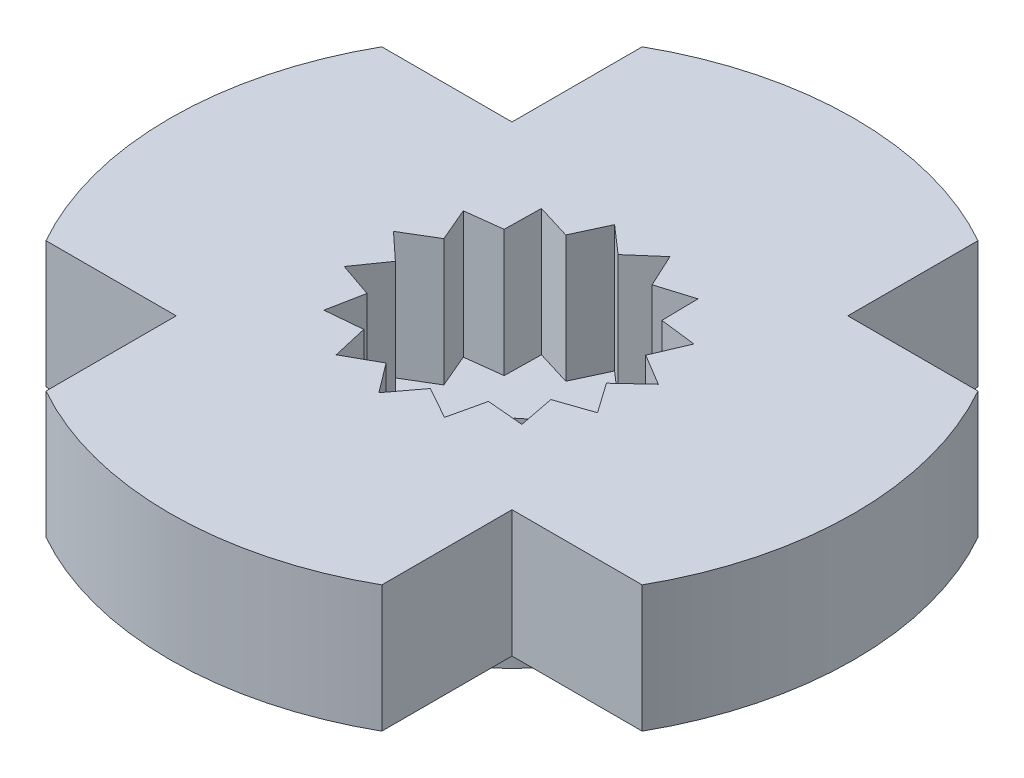
from build123d import *

# Parameters (mm, degrees)
EXTRUDE_1_DEPTH = 2
SKETCH_2_R      = 2.575
SKETCH_2_R_2    = 0.85
EXTRUDE_2_DEPTH = 1


with BuildPart() as part:
    # ｽｹｯﾁ1 → ﾎﾞｽ - 押し出し1 (new body)
    with BuildSketch(Plane(origin=(0, 0, 0), x_dir=(1, 0, 0), z_dir=(0, 1, 0))):
        with BuildLine():
            Line((2.65, 4.705050478), (2.65, 2.65))
            Line((2.65, 2.65), (4.705050478, 2.65))
            ThreePointArc((4.705050478, 2.65), (5.4, 0), (4.705050478, -2.65))
            Line((4.705050478, -2.65), (2.65, -2.65))
            Line((2.65, -2.65), (2.65, -4.705050478))
            ThreePointArc((2.65, -4.705050478), (0, -5.4), (-2.65, -4.705050478))
            Line((-2.65, -4.705050478), (-2.65, -2.65))
            Line((-2.65, -2.65), (-4.705050478, -2.65))
            ThreePointArc((-4.705050478, -2.65), (-5.4, 0), (-4.705050478, 2.65))
            Line((-4.705050478, 2.65), (-2.65, 2.65))
            Line((-2.65, 2.65), (-2.65, 4.705050478))
            ThreePointArc((-2.65, 4.705050478), (0, 5.4), (2.65, 4.705050478))
        make_face()
        Polygon((0, 1.675), (0.437016815, 2.056002469), (0.681283877, 1.530188642), (1.235486269, 1.700500964), (1.244767583, 1.120793766), (1.820328922, 1.050967393), (1.593019665, 0.517603466), (2.090420168, 0.219712013), (1.665824175, -0.175085176), (1.999058776, -0.64953357), (1.450592551, -0.8375), (1.56204196, -1.406468898), (0.984540298, -1.355103466), (0.854933899, -1.920212977), (0.348252082, -1.638397231), (0, -2.101934787), (-0.348252082, -1.638397231), (-0.854933899, -1.920212977), (-0.984540298, -1.355103466), (-1.56204196, -1.406468898), (-1.450592551, -0.8375), (-1.999058776, -0.64953357), (-1.665824175, -0.175085176), (-2.090420168, 0.219712013), (-1.593019665, 0.517603466), (-1.820328922, 1.050967393), (-1.244767583, 1.120793766), (-1.235486269, 1.700500964), (-0.681283877, 1.530188642), (-0.437016815, 2.056002469), align=None, mode=Mode.SUBTRACT)
    extrude(amount=EXTRUDE_1_DEPTH)

    # ｽｹｯﾁ2 → ﾎﾞｽ - 押し出し2 (add)
    with BuildSketch(Plane.XZ):
        with Locations(Location((0, 0, 0), (0, 0, 90))):
            Circle(SKETCH_2_R)
        with Locations(Location((0, 0, 0), (0, 0, 270))):
            Circle(SKETCH_2_R_2, mode=Mode.SUBTRACT)
    extrude(amount=EXTRUDE_2_DEPTH)


solid = part.part
